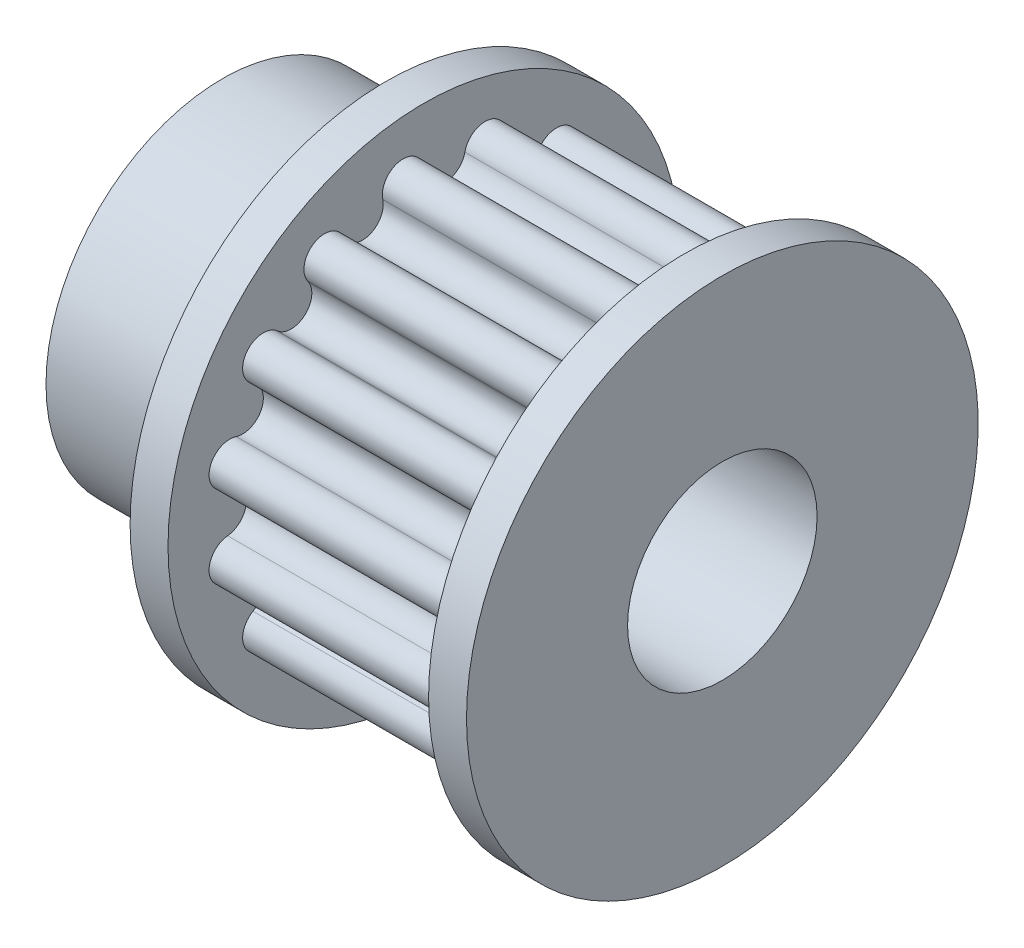
from build123d import *

# Parameters (mm, degrees)
CUT_EXTRUDE1_START = 11
CUT_EXTRUDE1_DEPTH = 11


with BuildPart() as part:
    # Sketch1 → Revolve2 (revolve)
    with BuildSketch(Plane.XY, mode=Mode.PRIVATE) as revolve2_sk:
        Polygon((0, 4), (0, 7.45), (6.9, 7.45), (6.9, 10.8), (8.5, 10.8), (8.5, 9.25), (19.5, 9.25), (19.5, 10.8), (21.1, 10.8), (21.1, 4), align=None)
    revolve(revolve2_sk.sketch.rotate(Axis((0, 0, 0), (1, 0, 0)), 90), axis=Axis((0, 0, 0), (1, 0, 0)))

    # Sketch4 → Cut-Extrude1 (cut)
    with BuildSketch(Plane(origin=(8.5, 0, 0), x_dir=(0, 0, -1), z_dir=(1, 0, 0)).offset(CUT_EXTRUDE1_START)):
        with BuildLine():
            ThreePointArc((7.212898178, 4.164368705), (7.921100382, 4.238803586), (8.450295822, 3.762313188))
            ThreePointArc((8.450295822, 3.762313188), (7.483407656, 5.437012953), (6.189458648, 6.87408915))
            ThreePointArc((6.189458648, 6.87408915), (6.479096404, 6.223551012), (6.189458109, 5.573013113))
            ThreePointArc((6.189458109, 5.573013113), (6.067003582, 4.40793612), (7.212898178, 4.164368705))
        make_face()
        with BuildLine():
            ThreePointArc((8.283111715, 0.870590122), (8.960361705, 0.650538261), (9.25, 0))
            ThreePointArc((9.25, 0), (9.047865393, 1.923182733), (8.450295822, 3.762313188))
            ThreePointArc((8.450295822, 3.762313188), (8.450295314, 3.050210787), (7.921099986, 2.573721401))
            ThreePointArc((7.921099986, 2.573721401), (7.335352705, 1.55917735), (8.283111715, 0.870590122))
        make_face()
        with BuildLine():
            ThreePointArc((8.450295822, -3.762313187), (9.047865393, -1.923182732), (9.25, 0))
            ThreePointArc((9.25, 0), (8.960361705, -0.650538261), (8.283111715, -0.870590122))
            ThreePointArc((8.283111715, -0.870590122), (7.335352705, -1.55917735), (7.921099986, -2.573721401))
            ThreePointArc((7.921099986, -2.573721401), (8.450295314, -3.050210786), (8.450295822, -3.762313187))
        make_face()
        with BuildLine():
            ThreePointArc((6.189458648, -6.87408915), (7.483407656, -5.437012953), (8.450295822, -3.762313187))
            ThreePointArc((8.450295822, -3.762313187), (7.921100382, -4.238803585), (7.212898178, -4.164368705))
            ThreePointArc((7.212898178, -4.164368705), (6.067003582, -4.40793612), (6.189458109, -5.573013113))
            ThreePointArc((6.189458109, -5.573013113), (6.479096404, -6.223551011), (6.189458648, -6.87408915))
        make_face()
        with BuildLine():
            ThreePointArc((2.858407704, -8.797272611), (4.625000545, -8.010734671), (6.189458648, -6.87408915))
            ThreePointArc((6.189458648, -6.87408915), (5.512208479, -7.094141535), (4.89550902, -6.738090106))
            ThreePointArc((4.89550902, -6.738090106), (3.749614424, -6.494522691), (3.387602695, -7.608680229))
            ThreePointArc((3.387602695, -7.608680229), (3.387602803, -8.320782767), (2.858407704, -8.797272611))
        make_face()
        with BuildLine():
            ThreePointArc((-0.966888273, -9.199327533), (0.966888556, -9.199327504), (2.858407704, -8.797272611))
            ThreePointArc((2.858407704, -8.797272611), (2.15020562, -8.722837899), (1.731641877, -8.146734514))
            ThreePointArc((1.731641877, -8.146734514), (0.783882867, -7.458147287), (0, -8.32873741))
            ThreePointArc((0, -8.32873741), (-0.28963829, -8.979275667), (-0.966888273, -9.199327533))
        make_face()
        with BuildLine():
            ThreePointArc((-4.625000007, -8.010734981), (-2.858407196, -8.797272776), (-0.966888273, -9.199327533))
            ThreePointArc((-0.966888273, -9.199327533), (-1.58358738, -8.843276147), (-1.731641877, -8.146734514))
            ThreePointArc((-1.731641877, -8.146734514), (-2.317389159, -7.132190463), (-3.387602695, -7.608680229))
            ThreePointArc((-3.387602695, -7.608680229), (-3.916798196, -8.085169996), (-4.625000007, -8.010734981))
        make_face()
        with BuildLine():
            ThreePointArc((-7.483407198, -5.437013584), (-6.189458111, -6.874089633), (-4.625000007, -8.010734981))
            ThreePointArc((-4.625000007, -8.010734981), (-5.043563514, -7.434631729), (-4.89550902, -6.738090106))
            ThreePointArc((-4.89550902, -6.738090106), (-5.017963546, -5.573013113), (-6.189458109, -5.573013113))
            ThreePointArc((-6.189458109, -5.573013113), (-6.866708099, -5.793064974), (-7.483407198, -5.437013584))
        make_face()
        with BuildLine():
            ThreePointArc((-9.047865313, -1.923183112), (-8.450295489, -3.762313935), (-7.483407198, -5.437013584))
            ThreePointArc((-7.483407198, -5.437013584), (-7.631461691, -4.740471957), (-7.212898178, -4.164368705))
            ThreePointArc((-7.212898178, -4.164368705), (-6.85088645, -3.050211167), (-7.921099986, -2.573721401))
            ThreePointArc((-7.921099986, -2.573721401), (-8.629301806, -2.499286385), (-9.047865313, -1.923183112))
        make_face()
        with BuildLine():
            ThreePointArc((-8.283111715, 0.870590122), (-8.899810818, 1.226641519), (-9.047865304, 1.923183154))
            ThreePointArc((-9.047865304, 1.923183154), (-9.25, 2.2e-08), (-9.047865313, -1.923183112))
            ThreePointArc((-9.047865313, -1.923183112), (-8.899810805, -1.226641501), (-8.283111715, -0.870590122))
            ThreePointArc((-8.283111715, -0.870590122), (-7.499228848, 0), (-8.283111715, 0.870590122))
        make_face()
        with BuildLine():
            ThreePointArc((-7.212898178, 4.164368705), (-7.631461691, 4.740471957), (-7.483407198, 5.437013584))
            ThreePointArc((-7.483407198, 5.437013584), (-8.45029548, 3.762313955), (-9.047865304, 1.923183154))
            ThreePointArc((-9.047865304, 1.923183154), (-8.629301788, 2.499286395), (-7.921099986, 2.573721401))
            ThreePointArc((-7.921099986, 2.573721401), (-6.85088645, 3.050211167), (-7.212898178, 4.164368705))
        make_face()
        with BuildLine():
            ThreePointArc((-4.89550902, 6.738090106), (-5.043563514, 7.434631729), (-4.625000007, 8.010734981))
            ThreePointArc((-4.625000007, 8.010734981), (-6.189458111, 6.874089633), (-7.483407198, 5.437013584))
            ThreePointArc((-7.483407198, 5.437013584), (-6.866708099, 5.793064974), (-6.189458109, 5.573013113))
            ThreePointArc((-6.189458109, 5.573013113), (-5.017963546, 5.573013113), (-4.89550902, 6.738090106))
        make_face()
        with BuildLine():
            ThreePointArc((-1.731641877, 8.146734514), (-1.583587386, 8.843276139), (-0.966888291, 9.199327532))
            ThreePointArc((-0.966888291, 9.199327532), (-2.858407204, 8.797272774), (-4.625000007, 8.010734981))
            ThreePointArc((-4.625000007, 8.010734981), (-3.916798196, 8.085169996), (-3.387602695, 7.608680229))
            ThreePointArc((-3.387602695, 7.608680229), (-2.317389159, 7.132190463), (-1.731641877, 8.146734514))
        make_face()
        with BuildLine():
            ThreePointArc((1.731641877, 8.146734514), (2.15020538, 8.72283776), (2.858407176, 8.797272783))
            ThreePointArc((2.858407176, 8.797272783), (0.966888271, 9.199327534), (-0.966888291, 9.199327532))
            ThreePointArc((-0.966888291, 9.199327532), (-0.289638297, 8.979275673), (0, 8.32873741))
            ThreePointArc((0, 8.32873741), (0.783882867, 7.458147287), (1.731641877, 8.146734514))
        make_face()
        with BuildLine():
            ThreePointArc((4.89550902, 6.738090106), (5.512208479, 7.094141535), (6.189458648, 6.87408915))
            ThreePointArc((6.189458648, 6.87408915), (4.625000304, 8.010734809), (2.858407176, 8.797272783))
            ThreePointArc((2.858407176, 8.797272783), (3.38760269, 8.320783021), (3.387602695, 7.608680229))
            ThreePointArc((3.387602695, 7.608680229), (3.749614424, 6.494522691), (4.89550902, 6.738090106))
        make_face()
    extrude(amount=-CUT_EXTRUDE1_DEPTH, mode=Mode.SUBTRACT)


solid = part.part
